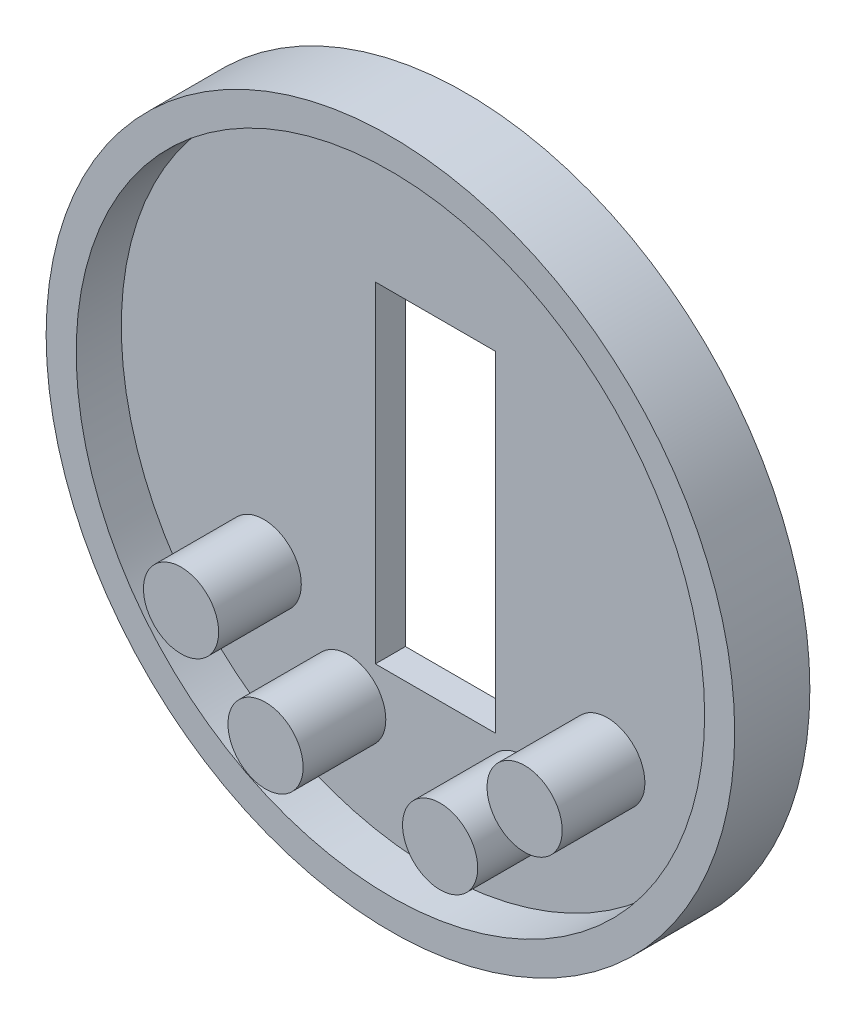
from build123d import *

# Parameters (mm, degrees)
SCHNITT_LINEAR_AUSTRAGEN1_DEPTH = 10
SKIZZE3_R                       = 2.5
AUFSATZ_LINEAR_AUSTRAGEN1_DEPTH = 7.5
AUFSATZ_LINEAR_AUSTRAGEN2_DEPTH = 7.5
SKIZZE3_6_R                     = 2.5
AUFSATZ_LINEAR_AUSTRAGEN3_DEPTH = 7.5
SKIZZE3_7_R                     = 2.5
AUFSATZ_LINEAR_AUSTRAGEN4_DEPTH = 7.5


with BuildPart() as part:
    # Skizze1 → Rotation2 (revolve)
    with BuildSketch(Plane(origin=(0, 0, 0), x_dir=(1, 0, 0), z_dir=(0, 1, 0))):
        Polygon((0, 0), (22.902, 0), (22.902, -5), (20.902, -5), (20.902, -2), (0, -2), align=None)
    revolve(axis=Axis((0, 0, 2), (0, 0, -1)))

    # Skizze2 → Schnitt-Linear austragen1 (cut)
    with BuildSketch(Plane(origin=(0, 0, 0), x_dir=(-1, 0, 0), z_dir=(0, 0, -1))):
        Polygon((4, 0), (4, 11), (-4, 11), (-4, -11), (4, -11), align=None)
    extrude(amount=-SCHNITT_LINEAR_AUSTRAGEN1_DEPTH, mode=Mode.SUBTRACT)

    # Skizze3 → Aufsatz-Linear austragen1 (add)
    with BuildSketch(Plane.XY):
        with Locations((11.4275, -8.885)):
            Circle(SKIZZE3_R)
    extrude(amount=AUFSATZ_LINEAR_AUSTRAGEN1_DEPTH)

    # Skizze3<5> → Aufsatz-Linear austragen2 (add)
    with BuildSketch(Plane.XY):
        with BuildLine():
            ThreePointArc((8.3065, -13.863), (5.8065, -11.363), (3.3065, -13.863))
            ThreePointArc((3.3065, -13.863), (5.8065, -16.363), (8.3065, -13.863))
        make_face()
    extrude(amount=AUFSATZ_LINEAR_AUSTRAGEN2_DEPTH)

    # Skizze3<6> → Aufsatz-Linear austragen3 (add)
    with BuildSketch(Plane.XY):
        with Locations((-5.8065, -13.863)):
            Circle(SKIZZE3_6_R)
    extrude(amount=AUFSATZ_LINEAR_AUSTRAGEN3_DEPTH)

    # Skizze3<7> → Aufsatz-Linear austragen4 (add)
    with BuildSketch(Plane.XY):
        with Locations((-11.4275, -8.885)):
            Circle(SKIZZE3_7_R)
    extrude(amount=AUFSATZ_LINEAR_AUSTRAGEN4_DEPTH)


solid = part.part
